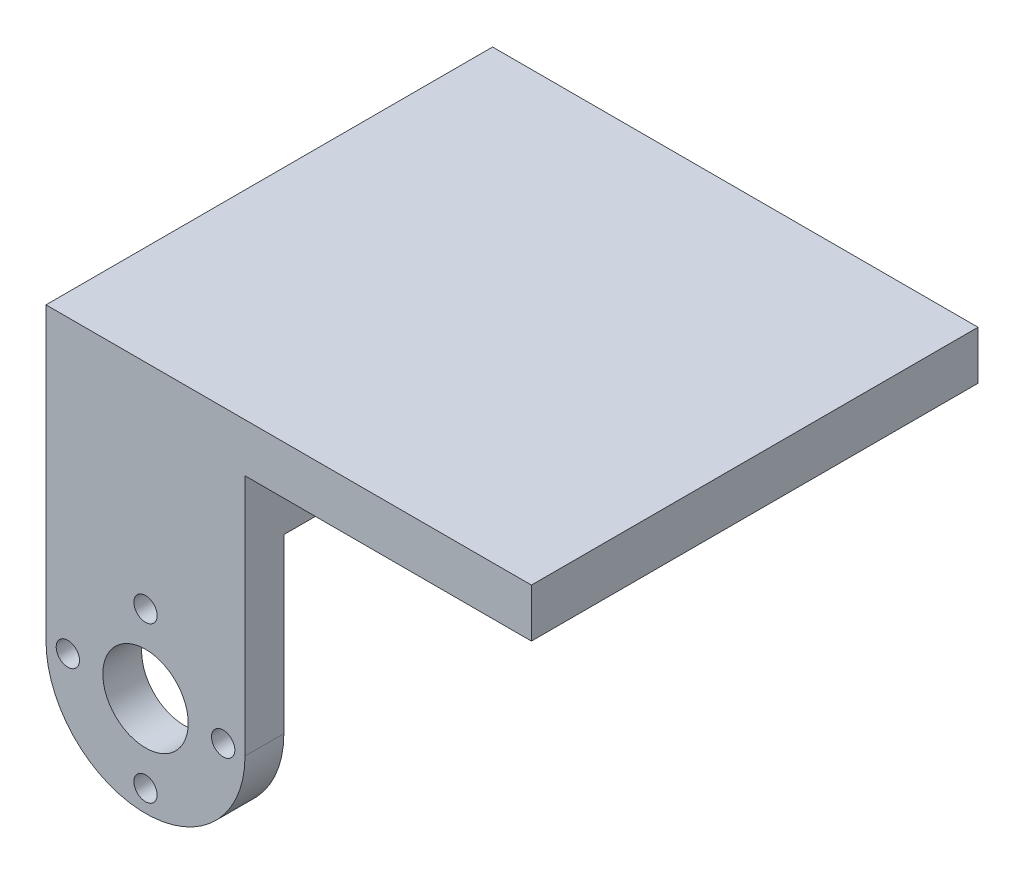
from build123d import *

# Parameters (mm, degrees)
SKETCH1_W           = 50
SKETCH1_H           = 5
BOSS_EXTRUDE1_DEPTH = 46
SKETCH2_W           = 38
SKETCH2_H           = 28
CUT_EXTRUDE1_DEPTH  = 46


with BuildPart() as part:
    # Sketch1 → Boss-Extrude1 (new body)
    with BuildSketch(Plane.XY):
        with BuildLine():
            ThreePointArc((-10.25, 0), (0, 10.25), (10.25, 0))
            Line((10.25, 0), (10.25, 25))
            Line((10.25, 25), (-10.25, 25))
            Line((-10.25, 25), (-10.25, 0))
        make_face()
        with BuildLine():
            Line((9.2, 0), (10.25, 0))
            ThreePointArc((10.25, 0), (0, 10.25), (-10.25, 0))
            Line((-10.25, 0), (-9.2, 0))
            ThreePointArc((-9.2, 0), (-8.816088231, 0.879772698), (-7.91, 1.196620241))
            ThreePointArc((-7.91, 1.196620241), (-5.656854249, 5.656854249), (-1.196620241, 7.91))
            ThreePointArc((-1.196620241, 7.91), (-0.045031719, 9.199154762), (1.2, 8))
            ThreePointArc((1.2, 8), (1.199154762, 7.954968281), (1.196620241, 7.91))
            ThreePointArc((1.196620241, 7.91), (5.656854249, 5.656854249), (7.91, 1.196620241))
            ThreePointArc((7.91, 1.196620241), (8.816088231, 0.879772698), (9.2, 0))
        make_face()
        with BuildLine():
            ThreePointArc((6.8, 0), (7.120227302, 0.816088231), (7.91, 1.196620241))
            ThreePointArc((7.91, 1.196620241), (5.656854249, 5.656854249), (1.196620241, 7.91))
            ThreePointArc((1.196620241, 7.91), (0, 6.8), (-1.196620241, 7.91))
            ThreePointArc((-1.196620241, 7.91), (-5.656854249, 5.656854249), (-7.91, 1.196620241))
            ThreePointArc((-7.91, 1.196620241), (-7.120227302, 0.816088231), (-6.8, 0))
            Line((-6.8, 0), (-4.4, 0))
            ThreePointArc((-4.4, 0), (0, 4.4), (4.4, 0))
            Line((4.4, 0), (6.8, 0))
        make_face()
        with BuildLine():
            ThreePointArc((-10.25, 0), (0, -10.25), (10.25, 0))
            Line((10.25, 0), (9.2, 0))
            ThreePointArc((9.2, 0), (8.816088231, -0.879772698), (7.91, -1.196620241))
            ThreePointArc((7.91, -1.196620241), (5.656854249, -5.656854249), (1.196620241, -7.91))
            ThreePointArc((1.196620241, -7.91), (1.199154762, -7.954968281), (1.2, -8))
            ThreePointArc((1.2, -8), (-0.045031719, -9.199154762), (-1.196620241, -7.91))
            ThreePointArc((-1.196620241, -7.91), (-5.656854249, -5.656854249), (-7.91, -1.196620241))
            ThreePointArc((-7.91, -1.196620241), (-8.816088231, -0.879772698), (-9.2, 0))
            Line((-9.2, 0), (-10.25, 0))
        make_face()
        with BuildLine():
            ThreePointArc((1.196620241, -7.91), (5.656854249, -5.656854249), (7.91, -1.196620241))
            ThreePointArc((7.91, -1.196620241), (7.120227302, -0.816088231), (6.8, 0))
            Line((6.8, 0), (4.4, 0))
            ThreePointArc((4.4, 0), (0, -4.4), (-4.4, 0))
            Line((-4.4, 0), (-6.8, 0))
            ThreePointArc((-6.8, 0), (-7.120227302, -0.816088231), (-7.91, -1.196620241))
            ThreePointArc((-7.91, -1.196620241), (-5.656854249, -5.656854249), (-1.196620241, -7.91))
            ThreePointArc((-1.196620241, -7.91), (0, -6.8), (1.196620241, -7.91))
        make_face()
        with Locations((14.75, 27.5)):
            Rectangle(SKETCH1_W, SKETCH1_H)
    extrude(amount=-BOSS_EXTRUDE1_DEPTH)

    # Sketch2 → Cut-Extrude1 (cut)
    with BuildSketch(Plane.ZY.offset(10.25)):
        with Locations((-23, 3.75)):
            Rectangle(SKETCH2_W, SKETCH2_H)
    extrude(amount=-CUT_EXTRUDE1_DEPTH, mode=Mode.SUBTRACT)


solid = part.part
